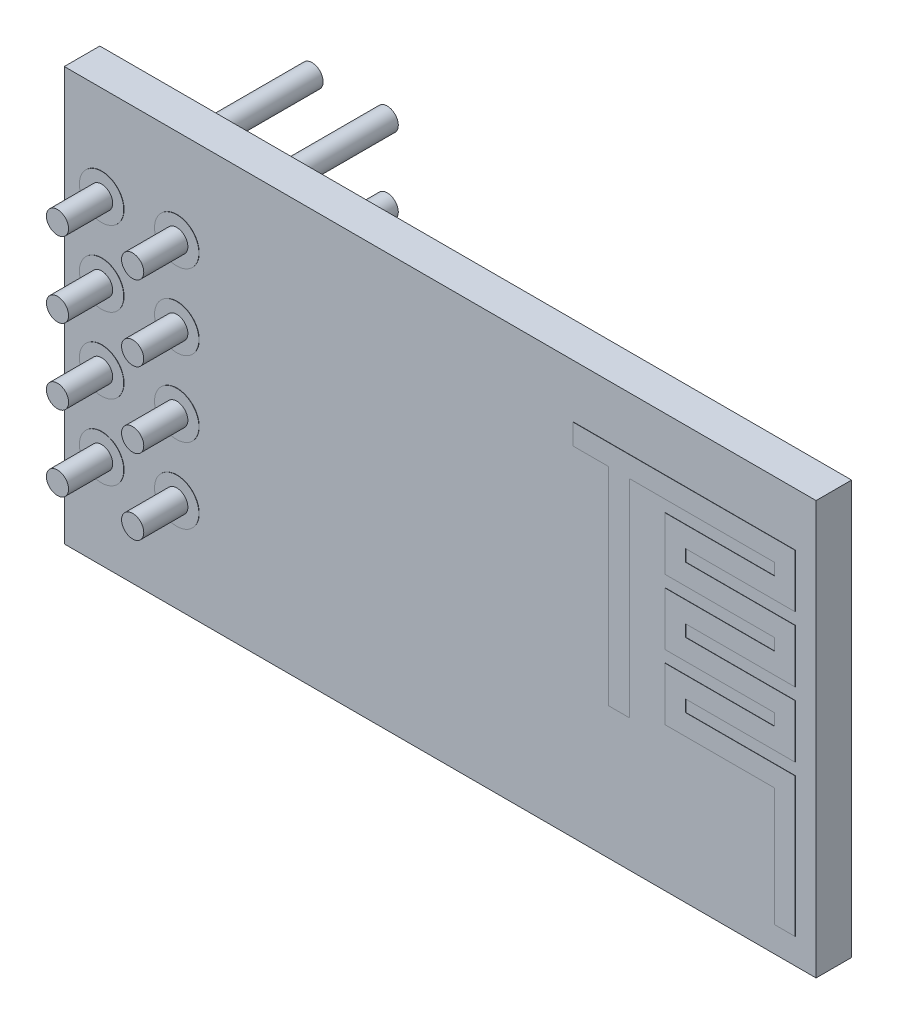
from build123d import *

# Parameters (mm, degrees)
SKETCH2_W                = 25.4
SKETCH2_H                = 13.97
BOSS_EXTRUDE1_DEPTH      = 1.2
SKETCH3_R                = 0.75
BOSS_EXTRUDE2_DEPTH      = 0.01
BOSS_EXTRUDE3_DEPTH      = 1.5
BOSS_EXTRUDE3_DEPTH_BACK = 7.1
SKETCH4_R                = 0.375
BOSS_EXTRUDE4_DEPTH      = 0.01
SKETCH6_W                = 5
SKETCH6_H                = 8.97
BOSS_EXTRUDE5_DEPTH      = 2.2


with BuildPart() as part:
    # Sketch2 → Boss-Extrude1 (new body)
    with BuildSketch(Plane.XY):
        with Locations((12.7, 6.985)):
            Rectangle(SKETCH2_W, SKETCH2_H)
    extrude(amount=BOSS_EXTRUDE1_DEPTH)

    # Sketch3 → Boss-Extrude2 (add)
    with BuildSketch(Plane.XY.offset(1.2)):
        with Locations(Location((1.27, 10.795, 0), (0, 0, 180))):
            Circle(SKETCH3_R)
        with Locations(Location((3.81, 10.795, 0), (0, 0, 180))):
            Circle(SKETCH3_R)
        with Locations(Location((3.81, 8.255, 0), (0, 0, 180))):
            Circle(SKETCH3_R)
        with Locations(Location((3.81, 5.715, 0), (0, 0, 180))):
            Circle(SKETCH3_R)
        with Locations(Location((3.81, 3.175, 0), (0, 0, 180))):
            Circle(SKETCH3_R)
        with Locations(Location((1.27, 8.255, 0), (0, 0, 180))):
            Circle(SKETCH3_R)
        with Locations(Location((1.27, 5.715, 0), (0, 0, 180))):
            Circle(SKETCH3_R)
        with Locations(Location((1.27, 3.175, 0), (0, 0, 180))):
            Circle(SKETCH3_R)
    extrude(amount=BOSS_EXTRUDE2_DEPTH)

    # Sketch4 → Boss-Extrude3 (add, two sides: drawn at the far end of the back side and taken through both)
    with BuildSketch(Plane.XY.offset(1.2).offset(-BOSS_EXTRUDE3_DEPTH_BACK)):
        with Locations((1.27, 10.795)):
            Circle(SKETCH4_R)
        with Locations((3.81, 10.795)):
            Circle(SKETCH4_R)
        with Locations((3.81, 8.255)):
            Circle(SKETCH4_R)
        with Locations((3.81, 5.715)):
            Circle(SKETCH4_R)
        with Locations((3.81, 3.175)):
            Circle(SKETCH4_R)
        with Locations((1.27, 8.255)):
            Circle(SKETCH4_R)
        with Locations((1.27, 5.715)):
            Circle(SKETCH4_R)
        with Locations((1.27, 3.175)):
            Circle(SKETCH4_R)
    extrude(amount=BOSS_EXTRUDE3_DEPTH + BOSS_EXTRUDE3_DEPTH_BACK)

    # Sketch5 → Boss-Extrude4 (add)
    with BuildSketch(Plane.XY.offset(1.2)):
        Polygon((17.2, 12.17), (24.7, 12.17), (24.7, 10.37), (21, 10.37), (21, 9.97), (24.7, 9.97), (24.7, 8.17), (21, 8.17), (21, 7.77), (24.7, 7.77), (24.7, 5.97), (21, 5.97), (21, 5.57), (24.7, 5.57), (24.7, 0.87), (24, 0.87), (24, 4.87), (20.3, 4.87), (20.3, 6.67), (24, 6.67), (24, 7.07), (20.3, 7.07), (20.3, 8.87), (24, 8.87), (24, 9.27), (20.3, 9.27), (20.3, 11.07), (24, 11.07), (24, 11.47), (19.1, 11.47), (19.1, 4.47), (18.4, 4.47), (18.4, 11.47), (17.2, 11.47), align=None)
    extrude(amount=BOSS_EXTRUDE4_DEPTH)


with BuildPart() as body_2:
    # Sketch6 → Boss-Extrude5 (new body)
    with BuildSketch(Plane(origin=(0, 0, 0), x_dir=(-1, 0, 0), z_dir=(0, 0, -1))):
        with Locations((-2.6, 6.985)):
            Rectangle(SKETCH6_W, SKETCH6_H)
    extrude(amount=BOSS_EXTRUDE5_DEPTH)


solid = Compound([part.part, body_2.part])
